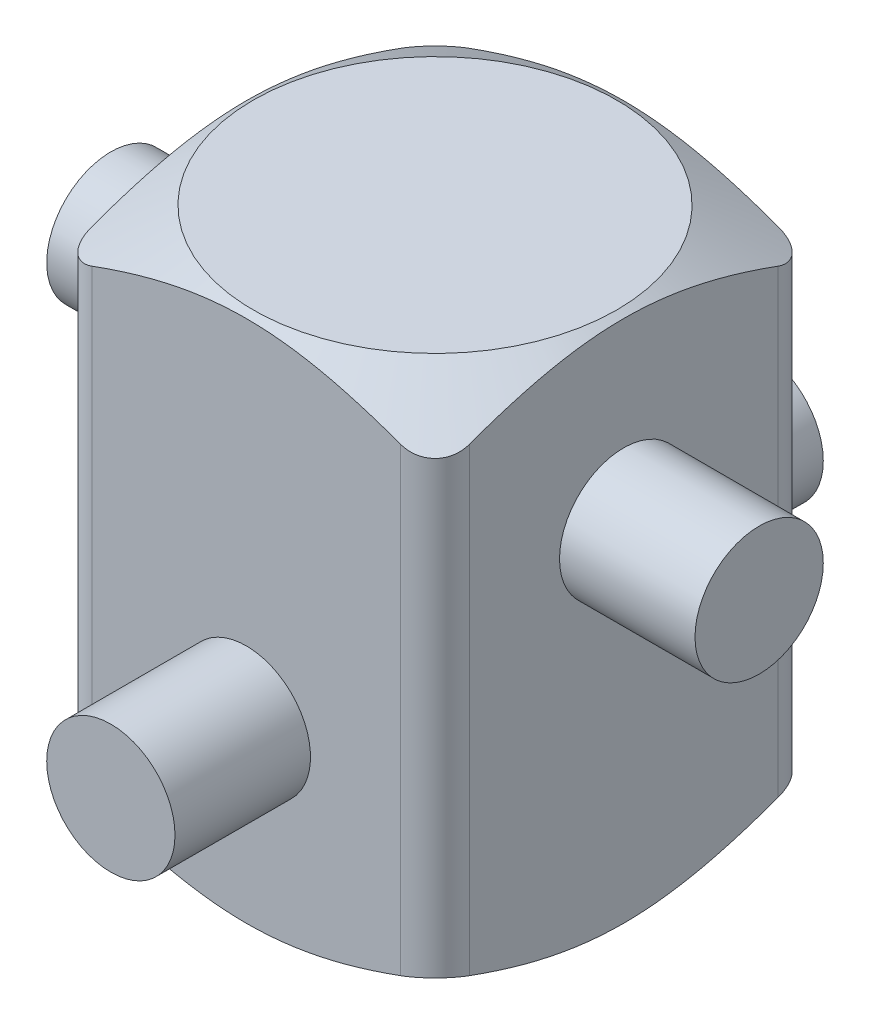
from build123d import *

# Parameters (mm, degrees)
INTERMEDIATE_BODY_SK_W  = 13.97
INTERMEDIATE_BODY_SK_H  = 13.97
INTERMEDIATE_BODY_DEPTH = 19.685
PIN1_R                  = 2.3749
PIN_EXTRUDE1_DEPTH      = 12.0015
PIN2_R                  = 2.3749
PIN_EXTRUDE2_DEPTH      = 12.0015
FILLET1_R               = 1.27


with BuildPart() as part:
    # Intermediate_Body-Sk → Intermediate_Body (new body)
    with BuildSketch(Plane(origin=(0, 0, 0), x_dir=(1, 0, 0), z_dir=(0, 1, 0))):
        Rectangle(INTERMEDIATE_BODY_SK_W, INTERMEDIATE_BODY_SK_H)
    extrude(amount=INTERMEDIATE_BODY_DEPTH)

    # Rev-CutSk → Cut-Revolve2 (revolve, cut)
    with BuildSketch(Plane.XY, mode=Mode.PRIVATE) as cut_revolve2_sk:
        Polygon((-6.731, 19.685), (-13.081, 16.018825791), (-13.081, 3.666174209), (-6.731, 0), (-15.621, 0), (-15.621, 19.685), align=None)
    revolve(cut_revolve2_sk.sketch.rotate(Axis((0, 0, 0), (0, 1, 0)), 180), axis=Axis((0, 0, 0), (0, 1, 0)), mode=Mode.SUBTRACT)

    # Pin1 → Pin-Extrude1 (add, symmetric)
    with BuildSketch(Plane.XY):
        with Locations(Location((0, 6.6675, 0), (0, 0, 180))):
            Circle(PIN1_R)
    extrude(amount=PIN_EXTRUDE1_DEPTH, both=True)

    # Pin2 → Pin-Extrude2 (add, symmetric)
    with BuildSketch(Plane(origin=(0, 0, 0), x_dir=(0, 0, -1), z_dir=(1, 0, 0))):
        with Locations((0, 13.0175)):
            Circle(PIN2_R)
    extrude(amount=PIN_EXTRUDE2_DEPTH, both=True)

    # Fillet1
    fillet1_edges = [part.edges().sort_by_distance(p)[0] for p in [
        (6.985, 9.8425, -6.985),
        (-6.985, 9.8425, -6.985),
        (-6.985, 9.8425, 6.985),
        (6.985, 9.8425, 6.985),
    ]]
    fillet(fillet1_edges, radius=FILLET1_R)


solid = part.part
